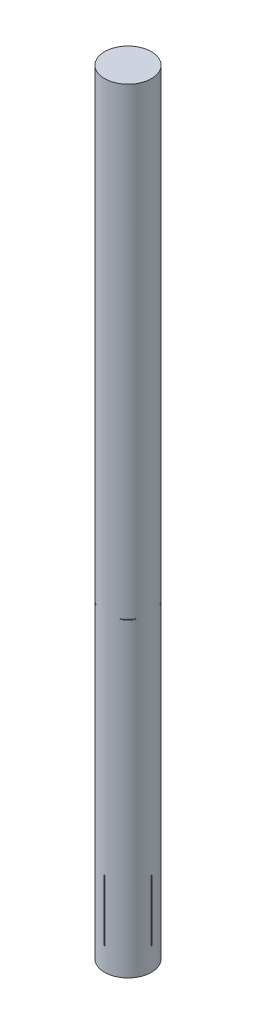
from build123d import *

# Parameters (mm, degrees)
SKETCH1_R           = 77.6224
SKETCH1_R_2         = 76.2
BOSS_EXTRUDE1_DEPTH = 2565.4
SKETCH2_W           = 4.7625
SKETCH2_H           = 203.2
CUT_EXTRUDE1_DEPTH  = 2568.747579877
CIRPATTERN1_COUNT   = 4
SKETCH3_W           = 38.1
SKETCH3_H           = 3.175
CUT_EXTRUDE2_DEPTH  = 2568.747579877
CIRPATTERN2_COUNT   = 4
SKETCH4_R           = 76.2
BOSS_EXTRUDE2_DEPTH = 2565.4


with BuildPart() as part:
    # Sketch1 → Boss-Extrude1 (new body)
    with BuildSketch(Plane(origin=(0, 0, 0), x_dir=(1, 0, 0), z_dir=(0, 1, 0))):
        with Locations(Location((0, 0, 0), (0, 0, 90))):
            Circle(SKETCH1_R)
        with Locations(Location((0, 0, 0), (0, 0, 90))):
            Circle(SKETCH1_R_2, mode=Mode.SUBTRACT)
    extrude(amount=BOSS_EXTRUDE1_DEPTH)

    # Sketch2 → Cut-Extrude1 (cut, through all)
    with BuildSketch(Plane.XY):
        with Locations((0, 177.8)):
            Rectangle(SKETCH2_W, SKETCH2_H)
    cut_extrude1 = extrude(amount=-CUT_EXTRUDE1_DEPTH, mode=Mode.SUBTRACT)

    # CirPattern1: Cut-Extrude1 ×4 about axis
    cirpattern1_axis = Axis((0, 0, 0), (0, 1, 0))
    for i in range(1, CIRPATTERN1_COUNT):
        add(cut_extrude1.rotate(cirpattern1_axis, i * 360 / CIRPATTERN1_COUNT), mode=Mode.SUBTRACT)

    # Sketch3 → Cut-Extrude2 (cut, through all)
    with BuildSketch(Plane(origin=(0, 0, 0), x_dir=(0.7071067811865477, 0, 0.7071067811865475), z_dir=(-0.7071067811865475, 0, 0.7071067811865477))):
        with Locations((0, 1029.0175)):
            Rectangle(SKETCH3_W, SKETCH3_H)
    cut_extrude2 = extrude(amount=-CUT_EXTRUDE2_DEPTH, mode=Mode.SUBTRACT)

    # CirPattern2: Cut-Extrude2 ×4 about axis
    cirpattern2_axis = Axis((0, 0, 0), (0, 1, 0))
    for i in range(1, CIRPATTERN2_COUNT):
        add(cut_extrude2.rotate(cirpattern2_axis, i * 360 / CIRPATTERN2_COUNT), mode=Mode.SUBTRACT)

    # Sketch4 → Boss-Extrude2 (add)
    with BuildSketch(Plane.XZ):
        Circle(SKETCH4_R)
    extrude(amount=-BOSS_EXTRUDE2_DEPTH)


solid = part.part
